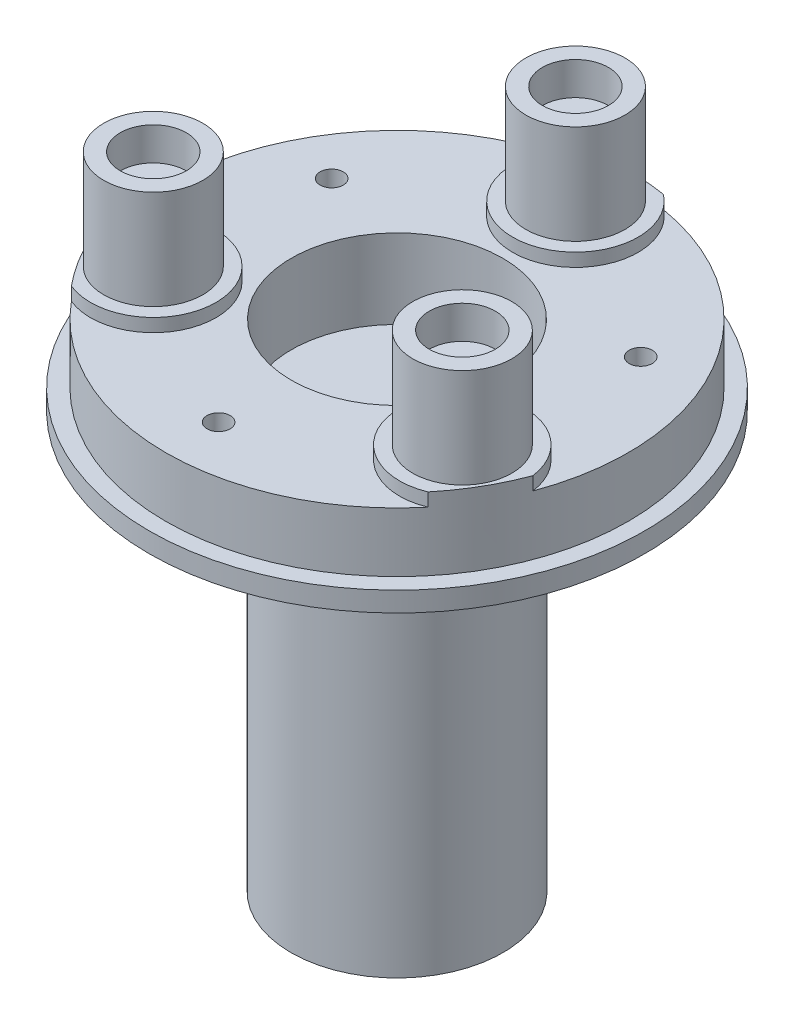
from build123d import *

# Parameters (mm, degrees)
SKETCH1_R                                     = 37.5
BOSS_EXTRUDE1_DEPTH                           = 3
SKETCH1_3_R                                   = 35
BOSS_EXTRUDE2_DEPTH                           = 12
SKETCH13_R                                    = 16
CUT_EXTRUDE6_DEPTH                            = 55.373706881
BOSS_EXTRUDE9_DEPTH                           = 2
SKETCH25_R                                    = 7.5
BOSS_EXTRUDE10_DEPTH                          = 15
SKETCH26_R                                    = 5
CUT_EXTRUDE9_DEPTH                            = 5
CBORE_FOR_M3_PAN_HEAD_MACHINE_SCREW1_AT_COUNT = 2
CBORE_FOR_M3_PAN_HEAD_MACHINE_SCREW1_AT_PITCH = 46.765371804
CBORE_FOR_M3_PAN_HEAD_MACHINE_SCREW1_2_COUNT  = 2
CBORE_FOR_M3_PAN_HEAD_MACHINE_SCREW1_2_PITCH  = 46.765371804
SKETCH29_R                                    = 1.75
CUT_EXTRUDE10_DEPTH                           = 56.691112397
SKETCH31_R                                    = 16.05
BOSS_EXTRUDE11_DEPTH                          = 63


with BuildPart() as part:
    # Sketch1 → Boss-Extrude1 (new body)
    with BuildSketch(Plane(origin=(0, 0, 0), x_dir=(1, 0, 0), z_dir=(0, 1, 0))):
        Circle(SKETCH1_R)
    extrude(amount=BOSS_EXTRUDE1_DEPTH)

    # Sketch1<3> → Boss-Extrude2 (add)
    with BuildSketch(Plane(origin=(0, 0, 0), x_dir=(1, 0, 0), z_dir=(0, 1, 0))):
        Circle(SKETCH1_3_R)
    extrude(amount=BOSS_EXTRUDE2_DEPTH)

    # Sketch13 → Cut-Extrude6 (cut, through all)
    with BuildSketch(Plane(origin=(0, 12, 0), x_dir=(1, 0, 0), z_dir=(0, 1, 0))):
        Circle(SKETCH13_R)
    extrude(amount=-CUT_EXTRUDE6_DEPTH, mode=Mode.SUBTRACT)

    # Sketch24 → Boss-Extrude9 (add)
    with BuildSketch(Plane(origin=(0, 12, 0), x_dir=(1, 0, 0), z_dir=(0, 1, 0))):
        with BuildLine():
            ThreePointArc((5.813043417, 34.513888889), (0, 35), (-5.813043417, 34.513888889))
            ThreePointArc((-5.813043417, 34.513888889), (0, 17.5), (5.813043417, 34.513888889))
        make_face()
        with BuildLine():
            ThreePointArc((-26.983382853, -22.291187717), (-15.155444566, -8.75), (-32.79642627, -12.222701172))
            ThreePointArc((-32.79642627, -12.222701172), (-30.310889132, -17.5), (-26.983382853, -22.291187717))
        make_face()
        with BuildLine():
            ThreePointArc((26.983382853, -22.291187717), (30.310889132, -17.5), (32.79642627, -12.222701172))
            ThreePointArc((32.79642627, -12.222701172), (15.155444566, -8.75), (26.983382853, -22.291187717))
        make_face()
    extrude(amount=BOSS_EXTRUDE9_DEPTH)

    # Sketch25 → Boss-Extrude10 (add)
    with BuildSketch(Plane(origin=(0, 14, 0), x_dir=(1, 0, 0), z_dir=(0, 1, 0))):
        with Locations((0, 27)):
            Circle(SKETCH25_R)
        with Locations((23.382685902, -13.5)):
            Circle(SKETCH25_R)
        with Locations((-23.382685902, -13.5)):
            Circle(SKETCH25_R)
    extrude(amount=BOSS_EXTRUDE10_DEPTH)

    # Sketch26 → Cut-Extrude9 (cut)
    with BuildSketch(Plane(origin=(0, 29, 0), x_dir=(1, 0, 0), z_dir=(0, 1, 0))):
        with Locations((0, 27)):
            Circle(SKETCH26_R)
        with Locations((23.382685902, -13.5)):
            Circle(SKETCH26_R)
        with Locations((-23.382685902, -13.5)):
            Circle(SKETCH26_R)
    extrude(amount=-CUT_EXTRUDE9_DEPTH, mode=Mode.SUBTRACT)

    # Sketch28 → CBORE for M3 Pan Head Machine Screw1 (revolve, cut)
    with BuildSketch(Plane(origin=(0, 0, -27), x_dir=(0, 0, -1), z_dir=(1, 0, 0))):
        Polygon((0, 0), (0, 29), (1.8, 29), (1.8, 2.4), (3.5, 2.4), (3.5, 0.025), (3.525, 0), align=None)
    cbore_for_m3_pan_head_machine_screw1 = revolve(axis=Axis((0, -6.35, -27), (0, 1, 0)), mode=Mode.SUBTRACT)

    # CBORE for M3 Pan Head Machine Screw1 at: CBORE for M3 Pan Head Machine Screw1 ×2
    with Locations(*[Vector(-0.5000000000000369, 0, 0.8660254037844174) * (i * CBORE_FOR_M3_PAN_HEAD_MACHINE_SCREW1_AT_PITCH) for i in range(1, CBORE_FOR_M3_PAN_HEAD_MACHINE_SCREW1_AT_COUNT)]):
        add(cbore_for_m3_pan_head_machine_screw1, mode=Mode.SUBTRACT)

    # CBORE for M3 Pan Head Machine Screw1 2: CBORE for M3 Pan Head Machine Screw1 ×2
    with Locations(*[Vector(0.49999999999996353, 0, 0.8660254037844598) * (i * CBORE_FOR_M3_PAN_HEAD_MACHINE_SCREW1_2_PITCH) for i in range(1, CBORE_FOR_M3_PAN_HEAD_MACHINE_SCREW1_2_COUNT)]):
        add(cbore_for_m3_pan_head_machine_screw1, mode=Mode.SUBTRACT)

    # Sketch29 → Cut-Extrude10 (cut, through all)
    with BuildSketch(Plane(origin=(0, 12, 0), x_dir=(1, 0, 0), z_dir=(0, 1, 0))):
        with Locations((23.382685902, 13.5)):
            Circle(SKETCH29_R)
        with Locations((0, -27)):
            Circle(SKETCH29_R)
        with Locations((-23.382685902, 13.5)):
            Circle(SKETCH29_R)
    extrude(amount=-CUT_EXTRUDE10_DEPTH, mode=Mode.SUBTRACT)


with BuildPart() as body_2:
    # Sketch31 → Boss-Extrude11 (new body)
    with BuildSketch(Plane.XZ):
        Circle(SKETCH31_R)
    extrude(amount=BOSS_EXTRUDE11_DEPTH)


solid = Compound([part.part, body_2.part])
